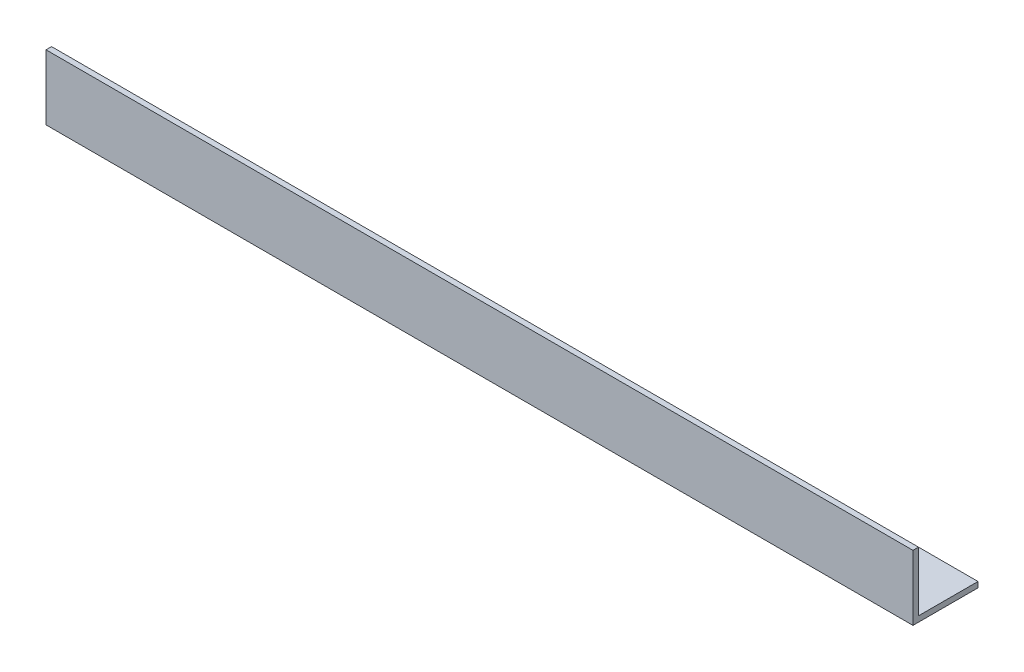
from build123d import *

# Parameters (mm, degrees)
BOSS_EXTRUDE1_DEPTH = 254


with BuildPart() as part:
    # Sketch1 → Boss-Extrude1 (new body)
    with BuildSketch(Plane(origin=(0, 0, 0), x_dir=(0, 0, -1), z_dir=(1, 0, 0))):
        Polygon((-7.8994, -7.8994), (9.525, -7.8994), (9.525, -9.525), (-9.525, -9.525), (-9.525, 9.525), (-7.8994, 9.525), align=None)
    extrude(amount=BOSS_EXTRUDE1_DEPTH)


solid = part.part
